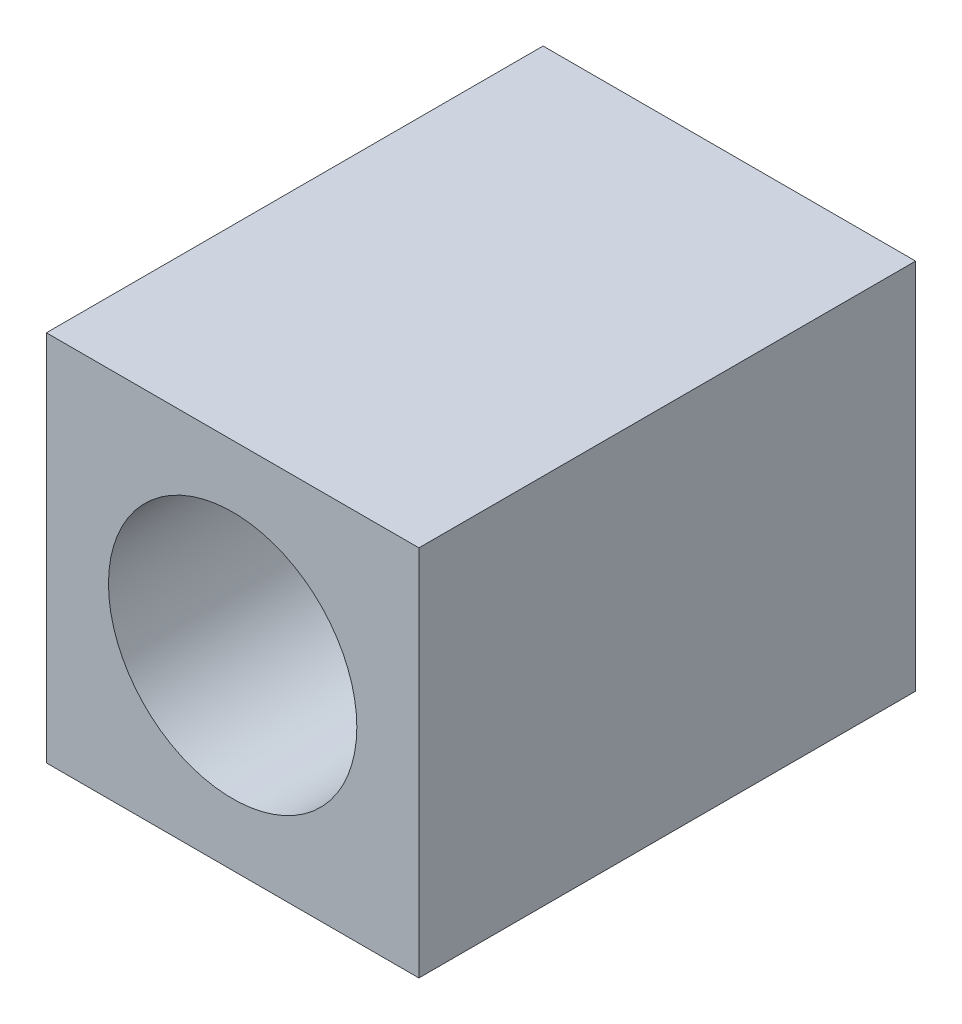
from build123d import *

# Parameters (mm, degrees)
SKETCH_1_W          = 6
SKETCH_1_H          = 6
EXTRUDE_1_DEPTH     = 8
SKETCH_2_R          = 2
CUT_EXTRUDE_1_DEPTH = 10.055385138


with BuildPart() as part:
    # 草图1 → 凸台-拉伸1 (new body)
    with BuildSketch(Plane.XY):
        Rectangle(SKETCH_1_W, SKETCH_1_H)
    extrude(amount=EXTRUDE_1_DEPTH)

    # 草图2 → 切除-拉伸1 (cut, through all)
    with BuildSketch(Plane.XY.offset(8)):
        Circle(SKETCH_2_R)
    extrude(amount=-CUT_EXTRUDE_1_DEPTH, mode=Mode.SUBTRACT)


solid = part.part
